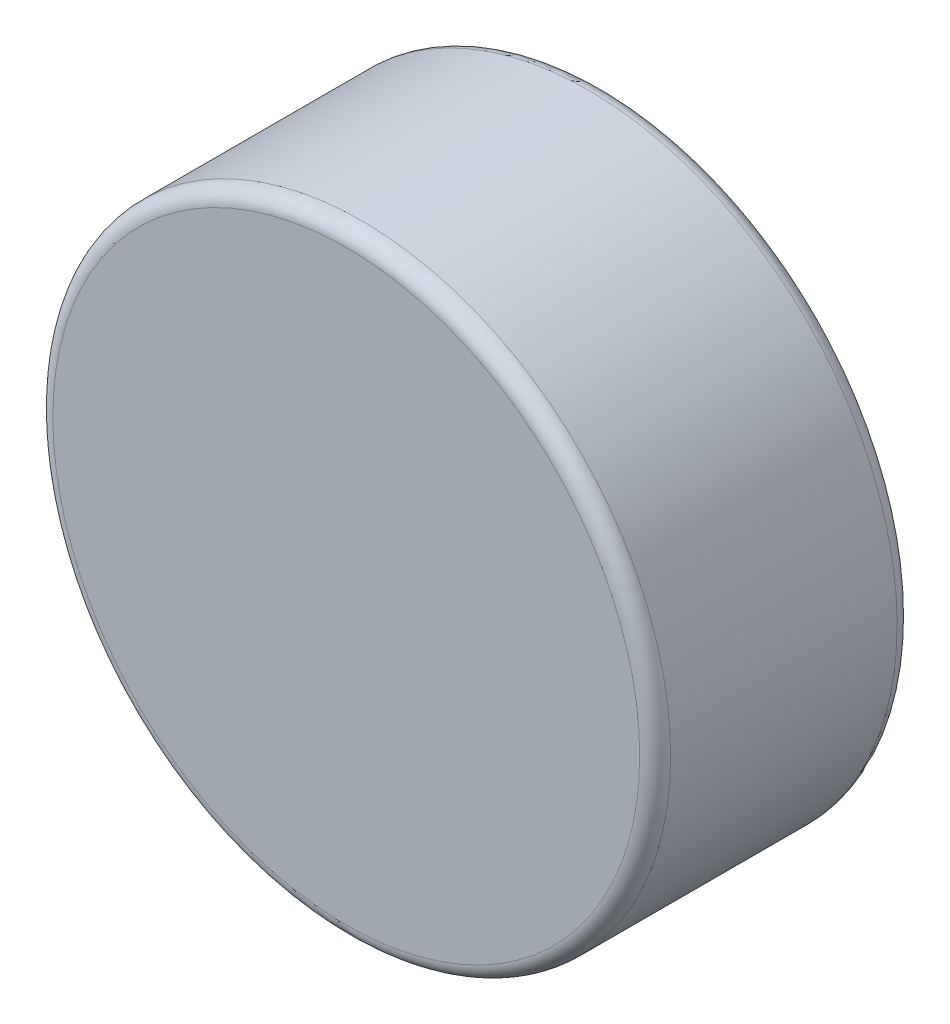
from build123d import *

# Parameters (mm, degrees)
SKICA1_R                = 3
P_IDAT_VYSUNUT_M1_DEPTH = 2.5
ZAOBLIT1_R              = 0.15


with BuildPart() as part:
    # Skica1 → Přidat vysunutím1 (new body)
    with BuildSketch(Plane.XY):
        Circle(SKICA1_R)
    extrude(amount=P_IDAT_VYSUNUT_M1_DEPTH)

    # Zaoblit1
    zaoblit1_edges = [part.edges().sort_by_distance(p)[0] for p in [
        (-3, 0, 0),
        (-3, 0, 2.5),
    ]]
    fillet(zaoblit1_edges, radius=ZAOBLIT1_R)


solid = part.part
